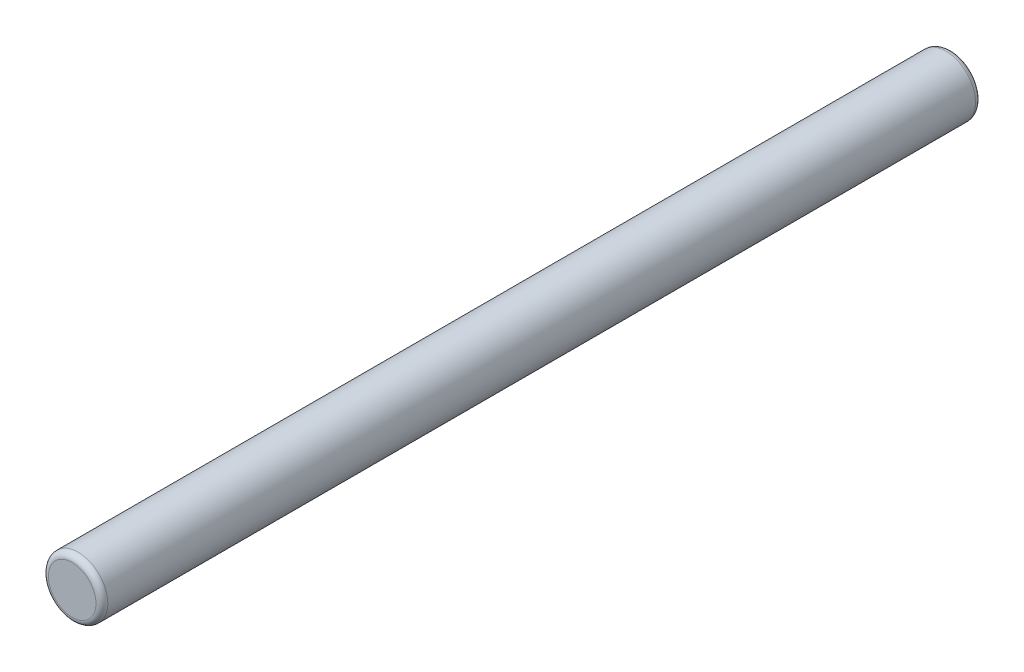
from build123d import *

# Parameters (mm, degrees)
SKETCH1_R           = 0.5
BOSS_EXTRUDE1_DEPTH = 7.4
FILLET1_R           = 0.1


with BuildPart() as part:
    # Sketch1 → Boss-Extrude1 (new, symmetric)
    with BuildSketch(Plane.XY):
        Circle(SKETCH1_R)
    extrude(amount=BOSS_EXTRUDE1_DEPTH, both=True)

    # Fillet1
    fillet1_edges = [part.edges().sort_by_distance(p)[0] for p in [
        (-0.5, 0, -7.4),
        (-0.5, 0, 7.4),
    ]]
    fillet(fillet1_edges, radius=FILLET1_R)


solid = part.part
